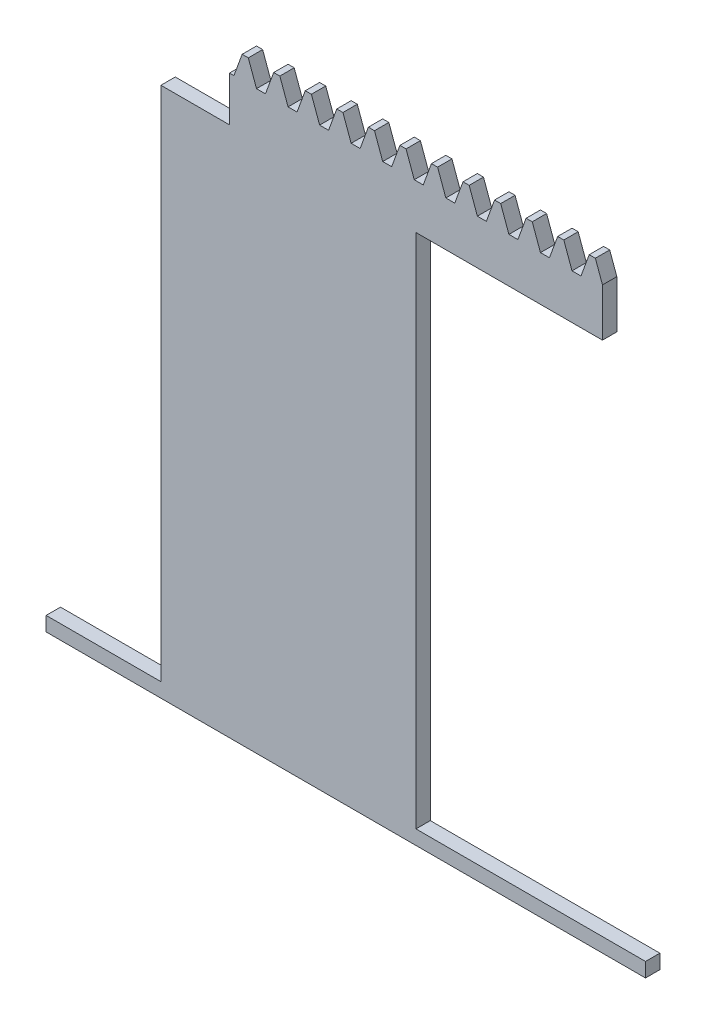
from build123d import *

# Parameters (mm, degrees)
BLANKSKE_W               = 26
BLANKSKE_H               = 4.7
BLANK_DEPTH              = 1
TOOTHCUTSIM_DEPTH        = 27.440310134
TEETHCUTS_COUNT          = 13
TEETHCUTS_PITCH          = 2.199114855
SKETCH3_W                = 17.77574145
SKETCH3_H                = 1
BOSS_EXTRUDE2_DEPTH      = 37
BOSS_EXTRUDE3_DEPTH      = 16
BOSS_EXTRUDE3_DEPTH_BACK = 25.775741
SKETCH4_W                = 1
SKETCH4_H                = 1


with BuildPart() as part:
    # BlankSke → Blank (new body)
    with BuildSketch(Plane.XY):
        with Locations((13, 2.35)):
            Rectangle(BLANKSKE_W, BLANKSKE_H)
    extrude(amount=-BLANK_DEPTH)

    # TooCutSkeSim → ToothCutSim (cut, through all)
    with BuildSketch(Plane.XY):
        Polygon((0.312304759, 3.125), (-0.312304759, 3.125), (-0.894802722, 4.7254), (0.894802722, 4.7254), align=None)
    toothcutsim = extrude(amount=-TOOTHCUTSIM_DEPTH, mode=Mode.SUBTRACT)

    # TeethCuts: ToothCutSim ×13
    with Locations(*[(i * TEETHCUTS_PITCH, 0, 0) for i in range(1, TEETHCUTS_COUNT)]):
        add(toothcutsim, mode=Mode.SUBTRACT)

    # Sketch3 → Boss-Extrude2 (add)
    with BuildSketch(Plane.XZ):
        with Locations((4.112129275, -0.5)):
            Rectangle(SKETCH3_W, SKETCH3_H)
    extrude(amount=BOSS_EXTRUDE2_DEPTH)

    # Sketch4 → Boss-Extrude3 (add, two sides: drawn at the far end of the back side and taken through both)
    with BuildSketch(Plane(origin=(13, 0, 0), x_dir=(0, 0, -1), z_dir=(1, 0, 0)).offset(-BOSS_EXTRUDE3_DEPTH_BACK)):
        with Locations((0.5, -36.5)):
            Rectangle(SKETCH4_W, SKETCH4_H)
    extrude(amount=BOSS_EXTRUDE3_DEPTH + BOSS_EXTRUDE3_DEPTH_BACK)


solid = part.part
